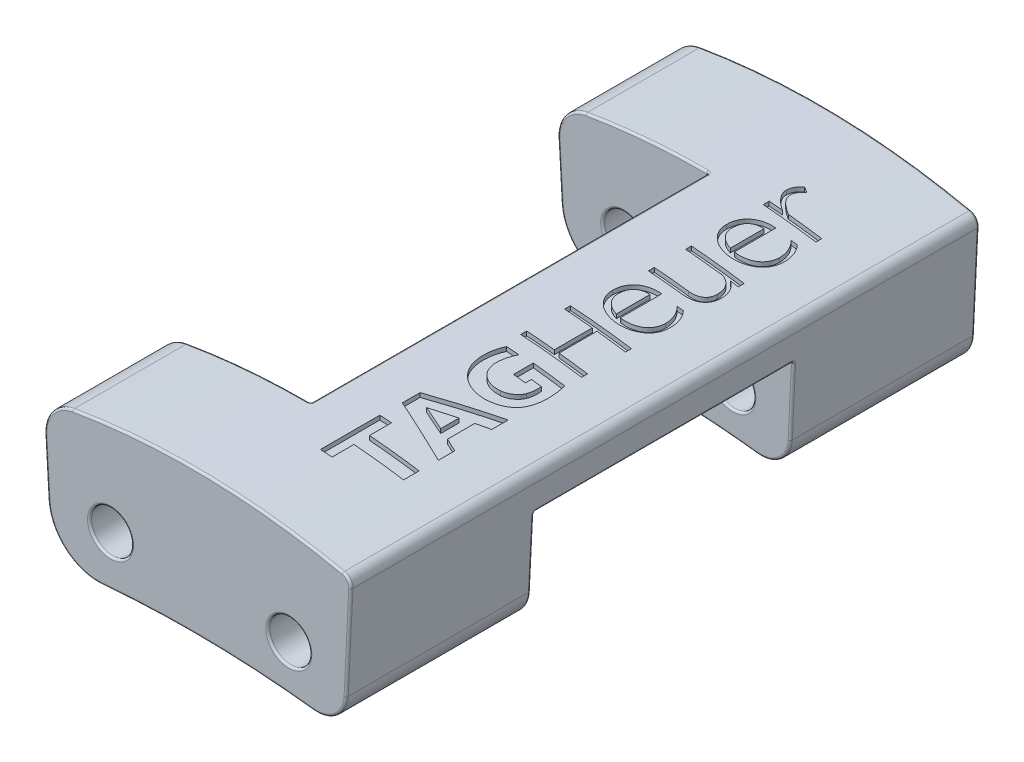
from build123d import *

# Parameters (mm, degrees)
SKETCH1_R               = 0.5
BOSS_EXTRUDE1_DEPTH     = 7.5
CUT_EXTRUDE1_DEPTH      = 15
SKETCH3_W               = 6.507782259
SKETCH3_H               = 9.5
CUT_EXTRUDE2_DEPTH      = 5
SKETCH4_W               = 15
SKETCH4_H               = 3.360747645
BOSS_EXTRUDE2_DEPTH     = 1.5
CUT_EXTRUDE3_DEPTH      = 16.644019284
BOSS_EXTRUDE3_DEPTH     = 15
SKETCH8_R               = 0.5
CUT_EXTRUDE4_DEPTH      = 16.644019284
FILLET1_R               = 0.25
FILLET2_R               = 0.7
CUT_EXTRUDE5_DEPTH      = 1
CUT_EXTRUDE5_DEPTH_BACK = 2
SKETCH9_W               = 7.495233053
SKETCH9_H               = 6.2
FILLET3_R               = 0.05
CUT_EXTRUDE6_REACH      = 20.717
CUT_EXTRUDE6_END_RADIUS = 16.9
CUT_EXTRUDE6_START      = 10


with BuildPart() as part:
    # Sketch1 → Boss-Extrude1 (new, symmetric)
    with BuildSketch(Plane.XY):
        with BuildLine():
            Line((3.214467516, 1.180191309), (3.139535455, -0.131119771))
            ThreePointArc((3.139535455, -0.131119771), (2.727253271, -0.969619698), (1.83856997, -1.258238334))
            ThreePointArc((1.83856997, -1.258238334), (-0.305594271, -1.166119811), (-2.449758512, -1.258238334))
            ThreePointArc((-2.449758512, -1.258238334), (-3.338441812, -0.969619698), (-3.750723996, -0.131119771))
            Line((-3.750723996, -0.131119771), (-3.825656058, 1.180191309))
            ThreePointArc((-3.825656058, 1.180191309), (-3.652789886, 1.724164053), (-3.161347372, 2.014462718))
            ThreePointArc((-3.161347372, 2.014462718), (-0.305594271, 2.256041723), (2.55015883, 2.014462718))
            ThreePointArc((2.55015883, 2.014462718), (3.041601344, 1.724164053), (3.214467516, 1.180191309))
        make_face()
        with Locations((-2.255594271, -0.070889968)):
            Circle(SKETCH1_R, mode=Mode.SUBTRACT)
    extrude(amount=BOSS_EXTRUDE1_DEPTH, both=True)

    # Sketch2 → Cut-Extrude1 (cut)
    with BuildSketch(Plane.XY.offset(7.5)):
        Polygon((1.83856997, -1.258238334), (2.048442209, 3.004085083), (6.043898684, 1.738990649), (3.82597996, -1.944195681), align=None)
    extrude(amount=-CUT_EXTRUDE1_DEPTH, mode=Mode.SUBTRACT)

    # Sketch3 → Cut-Extrude2 (cut, symmetric)
    with BuildSketch(Plane(origin=(0, 0, 0), x_dir=(1, 0, 0), z_dir=(0, 1, 0))):
        with Locations((-3.480850121, 0)):
            Rectangle(SKETCH3_W, SKETCH3_H)
    extrude(amount=CUT_EXTRUDE2_DEPTH, both=True, mode=Mode.SUBTRACT)

    # Sketch4 → Boss-Extrude2 (add)
    with BuildSketch(Plane(origin=(1.895927654, -0.093353447, 0), x_dir=(0, 0, -1), z_dir=(0.9987899637731681, -0.04917934796226596, 0))):
        with Locations((0, 0.514077676)):
            Rectangle(SKETCH4_W, SKETCH4_H)
    extrude(amount=BOSS_EXTRUDE2_DEPTH)

    # Sketch6 → Cut-Extrude3 (cut, through all)
    with BuildSketch(Plane.XY.offset(7.5)):
        with BuildLine():
            Line((-3.161347372, 2.014462718), (3.582877206, 4.079080063))
            Line((3.582877206, 4.079080063), (5.26786293, 2.202239529))
            Line((5.26786293, 2.202239529), (4.280334425, 1.625808307))
            ThreePointArc((4.280334425, 1.625808307), (0.58105107, 2.232904214), (-3.161347372, 2.014462718))
        make_face()
    extrude(amount=-CUT_EXTRUDE3_DEPTH, mode=Mode.SUBTRACT)

    # Sketch7 → Boss-Extrude3 (add)
    with BuildSketch(Plane.XY.offset(7.5)):
        with BuildLine():
            Line((3.378981184, -0.474428418), (3.336754915, -1.332007356))
            Line((3.336754915, -1.332007356), (3.331823925, -1.432151491))
            ThreePointArc((3.331823925, -1.432151491), (2.063975587, -1.27867039), (0.789943636, -1.190135412))
            Line((0.789943636, -1.190135412), (3.378981184, -0.474428418))
        make_face()
    extrude(amount=-BOSS_EXTRUDE3_DEPTH)

    # Sketch8 → Cut-Extrude4 (cut, through all)
    with BuildSketch(Plane.XY.offset(7.5)):
        with Locations((2, -0.2)):
            Circle(SKETCH8_R)
    extrude(amount=-CUT_EXTRUDE4_DEPTH, mode=Mode.SUBTRACT)

    # Fillet1
    fillet1_edges = [part.edges().sort_by_distance(p)[0] for p in [
        (3.492270691, 1.826383353, 0),
    ]]
    fillet(fillet1_edges, radius=FILLET1_R)

    # Fillet2
    fillet2_edges = [part.edges().sort_by_distance(p)[0] for p in [
        (3.331823925, -1.432151491, 0),
    ]]
    fillet(fillet2_edges, radius=FILLET2_R)

    # Sketch9 → Cut-Extrude5 (cut, two sides: drawn at the far end of the back side and taken through both)
    with BuildSketch(Plane(origin=(0, 0, 0), x_dir=(1, 0, 0), z_dir=(0, 1, 0)).offset(-CUT_EXTRUDE5_DEPTH_BACK)):
        with Locations((4.882888726, 0)):
            Rectangle(SKETCH9_W, SKETCH9_H)
    extrude(amount=CUT_EXTRUDE5_DEPTH + CUT_EXTRUDE5_DEPTH_BACK, mode=Mode.SUBTRACT)

    # Fillet3
    fillet3_edges = [part.edges().sort_by_distance(p)[0] for p in [
        (-3.788190027, 0.524535769, 7.5),
        (-3.652789886, 1.724164053, -7.5),
        (1.5, -0.2, -7.5),
        (1.5, -0.2, 7.5),
        (-3.338441812, -0.969619698, 7.5),
        (0.068622726, 2.251922449, 7.5),
        (0.068622726, 2.251922449, -7.5),
        (3.430562477, 1.780335166, -7.5),
        (3.42554491, 0.471240536, 7.5),
        (3.430562477, 1.780335166, 7.5),
        (3.122468898, -1.17309987, 7.5),
        (3.42554491, 0.471240536, -7.5),
        (3.122468898, -1.17309987, -7.5),
        (3.122468898, -1.17309987, -3.1),
        (3.122468898, -1.17309987, 3.1),
        (3.45158046, 1, 0),
        (1.135272199, -1.207676274, 0),
        (1.135272199, -0.103838137, -3.1),
        (3.41038249, 0.163304907, 3.1),
        (1.135272199, -0.103838137, 3.1),
        (1.5, -0.2, 3.1),
        (3.41038249, 0.163304907, -3.1),
        (1.5, -0.2, -3.1),
        (1.86305152, -1.260357919, 3.1),
        (1.86305152, -1.260357919, -3.1),
        (2.293426329, 1, -3.1),
        (1.135272199, 1, 0),
        (2.293426329, 1, 3.1),
        (0.071532724, -1.168964469, 7.5),
        (-2.755594271, -0.070889968, -7.5),
        (-2.755594271, -0.070889968, 7.5),
        (-0.226958991, -1.166243482, 0),
        (-0.226958991, 0.544808186, -4.75),
        (-0.226958991, 2.255859854, 0),
        (-3.652789886, 1.724164053, -4.75),
        (-1.699389088, 2.198808204, -4.75),
        (-1.339382564, -1.187503321, -4.75),
        (-3.338441812, -0.969619698, -4.75),
        (-3.788190027, 0.524535769, -4.75),
        (-2.755594271, -0.070889968, -4.75),
        (-0.226958991, 0.544808186, 4.75),
        (-1.699389088, 2.198808204, 4.75),
        (-3.652789886, 1.724164053, 4.75),
        (-3.788190027, 0.524535769, 4.75),
        (-3.338441812, -0.969619698, 4.75),
        (-1.339382564, -1.187503321, 4.75),
        (-2.755594271, -0.070889968, 4.75),
        (-3.652789886, 1.724164053, 7.5),
        (0.071532724, -1.168964469, -7.5),
        (-3.338441812, -0.969619698, -7.5),
        (-3.788190027, 0.524535769, -7.5),
    ]]
    fillet(fillet3_edges, radius=FILLET3_R)

    # Cut-Extrude6: up to this cylinder (the profile starts outside it)
    cut_extrude6_end = Plane(origin=(-0.305594271, -14.743958277, -0.0306075), z_dir=(0, 0, -1)) * Cylinder(CUT_EXTRUDE6_END_RADIUS, 86.012725, mode=Mode.PRIVATE)
    # Sketch11 → Cut-Extrude6 (cut, up to the surface)
    with BuildSketch(Plane(origin=(0, 0, 0), x_dir=(1, 0, 0), z_dir=(0, 1, 0)).offset(CUT_EXTRUDE6_START), mode=Mode.PRIVATE) as cut_extrude6_sk1:
        Polygon((2.284005039, -4.673143723), (1.099560127, -4.673143723), (1.099560127, -4.150187737), (0.82425228, -4.150187737), (0.82425228, -5.567337514), (1.099560127, -5.567337514), (1.099560127, -5.044352227), (2.284005039, -5.044352227), align=None)
    cut_extrude6_tool1 = extrude(cut_extrude6_sk1.sketch, amount=-CUT_EXTRUDE6_REACH, mode=Mode.PRIVATE) - cut_extrude6_end
    add(cut_extrude6_tool1.solids().sort_by_distance((1.348624, 10, 4.858755))[0], mode=Mode.SUBTRACT)
    # Sketch11 → Cut-Extrude6 (cut, up to the surface)
    with BuildSketch(Plane(origin=(0, 0, 0), x_dir=(1, 0, 0), z_dir=(0, 1, 0)).offset(CUT_EXTRUDE6_START), mode=Mode.PRIVATE) as cut_extrude6_sk2:
        with BuildLine():
            Line((0.914615137, -1.211871274), (1.203049624, -1.211871274))
            add(Edge.make_bspline(
                [(1.203049624, -1.211871274), (1.102724585, -1.430072374), (1.043771904, -1.758648597), (1.203049624, -1.968059536)],
                knots=[7, 7, 7, 7, 8, 8, 8, 8], degree=3))
            add(Edge.make_bspline(
                [(1.203049624, -1.968059536), (1.318376538, -2.118547094), (1.501446294, -2.164988446), (1.68451605, -2.127366556)],
                knots=[8, 8, 8, 8, 9, 9, 9, 9], degree=3))
            add(Edge.make_bspline(
                [(1.68451605, -2.127366556), (1.828791894, -2.097245604), (1.959237886, -1.973099228), (2.006821958, -1.835152299)],
                knots=[9, 9, 9, 9, 10, 10, 10, 10], degree=3))
            add(Edge.make_bspline(
                [(2.006821958, -1.835152299), (2.038232134, -1.737317806), (2.048311518, -1.617039101), (2.034481665, -1.507923901)],
                knots=[10, 10, 10, 10, 11, 11, 11, 11], degree=3))
            Line((2.034481665, -1.507923901), (1.799491357, -1.507923901))
            Line((1.799491357, -1.507923901), (1.799960166, -1.652053243))
            Line((1.799960166, -1.652053243), (1.516682573, -1.652053243))
            Line((1.516682573, -1.652053243), (1.516682573, -1.179582082))
            Line((1.516682573, -1.179582082), (2.269003164, -1.179582082))
            add(Edge.make_bspline(
                [(2.269003164, -1.179582082), (2.332995537, -1.463943795), (2.351747881, -1.830141908), (2.230092051, -2.094755058)],
                knots=[0, 0, 0, 0, 1, 1, 1, 1], degree=3))
            add(Edge.make_bspline(
                [(2.230092051, -2.094755058), (2.131056235, -2.320486396), (1.895245513, -2.459663947), (1.664474482, -2.488524977)],
                knots=[1, 1, 1, 1, 2, 2, 2, 2], degree=3))
            add(Edge.make_bspline(
                [(1.664474482, -2.488524977), (1.381079687, -2.518616628), (1.132728335, -2.412021274), (0.965949678, -2.185030013)],
                knots=[2, 2, 2, 2, 3, 3, 3, 3], degree=3))
            add(Edge.make_bspline(
                [(0.965949678, -2.185030013), (0.776668208, -1.920416862), (0.782879922, -1.500305761), (0.914615137, -1.211871274)],
                knots=[3, 3, 3, 3, 4, 4, 4, 4], degree=3))
        make_face()
    cut_extrude6_tool2 = extrude(cut_extrude6_sk2.sketch, amount=-CUT_EXTRUDE6_REACH, mode=Mode.PRIVATE) - cut_extrude6_end
    add(cut_extrude6_tool2.solids().sort_by_distance((1.058832, 10, 1.231813))[0], mode=Mode.SUBTRACT)
    # Sketch11 → Cut-Extrude6 (cut, up to the surface)
    with BuildSketch(Plane(origin=(0, 0, 0), x_dir=(1, 0, 0), z_dir=(0, 1, 0)).offset(CUT_EXTRUDE6_START), mode=Mode.PRIVATE) as cut_extrude6_sk3:
        Polygon((1.609155068, 0.248262392), (2.288224316, 0.247793583), (2.288224316, 0.388553363), (0.835386484, 0.388553363), (0.835386484, 0.247793583), (1.496289399, 0.248262392), (1.496289399, -0.657886019), (0.835386484, -0.657563713), (0.835386484, -0.798323493), (2.288224316, -0.798323493), (2.288224316, -0.657563713), (1.609155068, -0.657886019), align=None)
    cut_extrude6_tool3 = extrude(cut_extrude6_sk3.sketch, amount=-CUT_EXTRUDE6_REACH, mode=Mode.PRIVATE) - cut_extrude6_end
    add(cut_extrude6_tool3.solids().sort_by_distance((1.55999, 10, 0.204972))[0], mode=Mode.SUBTRACT)
    # Sketch11 → Cut-Extrude6 (cut, up to the surface)
    with BuildSketch(Plane(origin=(0, 0, 0), x_dir=(1, 0, 0), z_dir=(0, 1, 0)).offset(CUT_EXTRUDE6_START), mode=Mode.PRIVATE) as cut_extrude6_sk4:
        with BuildLine():
            Line((1.845200195, 2.194521269), (1.029942051, 2.194521269))
            Line((1.029942051, 2.194521269), (1.029942051, 2.054347499))
            Line((1.029942051, 2.054347499), (1.815196445, 2.054113095))
            add(Edge.make_bspline(
                [(1.815196445, 2.054113095), (2.290685561, 2.054113095), (2.317173247, 2.410290424), (2.317173247, 2.508974633)],
                knots=[7, 7, 7, 7, 8, 8, 8, 8], degree=3))
            add(Edge.make_bspline(
                [(2.317173247, 2.508974633), (2.317173247, 2.808426122), (2.098825644, 2.941567763)],
                knots=[8, 8, 8, 9, 9, 9], degree=2))
            Line((2.098825644, 2.941567763), (2.287286699, 2.941098954))
            Line((2.287286699, 2.941098954), (2.287286699, 3.081858734))
            Line((2.287286699, 3.081858734), (1.029942051, 3.081858734))
            Line((1.029942051, 3.081858734), (1.029942051, 2.941567763))
            Line((1.029942051, 2.941567763), (1.925366465, 2.941098954))
            add(Edge.make_bspline(
                [(1.925366465, 2.941098954), (2.204307578, 2.844524384), (2.204307578, 2.531008637)],
                knots=[0, 0, 0, 1, 1, 1], degree=2))
            add(Edge.make_bspline(
                [(2.204307578, 2.531008637), (2.204307578, 2.275976762), (2.0254571, 2.194521269), (1.845200195, 2.194521269)],
                knots=[1, 1, 1, 1, 2, 2, 2, 2], degree=3))
        make_face()
    cut_extrude6_tool4 = extrude(cut_extrude6_sk4.sketch, amount=-CUT_EXTRUDE6_REACH, mode=Mode.PRIVATE) - cut_extrude6_end
    add(cut_extrude6_tool4.solids().sort_by_distance((1.437571, 10, -2.178049))[0], mode=Mode.SUBTRACT)
    # Sketch11 → Cut-Extrude6 (cut, up to the surface)
    with BuildSketch(Plane(origin=(0, 0, 0), x_dir=(1, 0, 0), z_dir=(0, 1, 0)).offset(CUT_EXTRUDE6_START), mode=Mode.PRIVATE) as cut_extrude6_sk5:
        with BuildLine():
            Line((1.344629819, 4.935176308), (1.031817285, 4.935645116))
            Line((1.031817285, 4.935645116), (1.031817285, 4.794885336))
            Line((1.031817285, 4.794885336), (2.289161933, 4.794885336))
            Line((2.289161933, 4.794885336), (2.289161933, 4.935176308))
            Line((2.289161933, 4.935176308), (1.489960483, 4.935645116))
            add(Edge.make_bspline(
                [(1.489960483, 4.935645116), (1.143979741, 5.134888769), (1.143979741, 5.32534226)],
                knots=[9, 9, 9, 10, 10, 10], degree=2))
            add(Edge.make_bspline(
                [(1.143979741, 5.32534226), (1.143979741, 5.456022655), (1.283684702, 5.584007401)],
                knots=[10, 10, 10, 11, 11, 11], degree=2))
            Line((1.283684702, 5.584007401), (1.154527934, 5.659251181))
            add(Edge.make_bspline(
                [(1.154527934, 5.659251181), (1.009666079, 5.530914828), (1.009666079, 5.370347885)],
                knots=[0, 0, 0, 1, 1, 1], degree=2))
            add(Edge.make_bspline(
                [(1.009666079, 5.370347885), (1.009666079, 5.155281942), (1.344629819, 4.935176308)],
                knots=[1, 1, 1, 2, 2, 2], degree=2))
        make_face()
    cut_extrude6_tool5 = extrude(cut_extrude6_sk5.sketch, amount=-CUT_EXTRUDE6_REACH, mode=Mode.PRIVATE) - cut_extrude6_end
    add(cut_extrude6_tool5.solids().sort_by_distance((1.1882, 10, -4.91997))[0], mode=Mode.SUBTRACT)
    # Sketch11 → Cut-Extrude6 (cut, up to the surface)
    with BuildSketch(Plane(origin=(0, 0, 0), x_dir=(1, 0, 0), z_dir=(0, 1, 0)).offset(CUT_EXTRUDE6_START), mode=Mode.PRIVATE) as cut_extrude6_sk6:
        Polygon((2.006821958, -3.718942431), (2.2927952, -3.831016986), (2.2927952, -4.222296358), (0.83679291, -3.626528537), (0.83679291, -3.202110257), (2.2927952, -2.557498441), (2.2927952, -2.948777813), (2.006821958, -3.068236103), align=None)
        Polygon((1.742296709, -3.180779466), (1.198009932, -3.407243318), (1.742296709, -3.616595655), align=None, mode=Mode.SUBTRACT)
    cut_extrude6_tool6 = extrude(cut_extrude6_sk6.sketch, amount=-CUT_EXTRUDE6_REACH, mode=Mode.PRIVATE) - cut_extrude6_end
    add(cut_extrude6_tool6.solids().sort_by_distance((2.141739, 10, 3.795572))[0], mode=Mode.SUBTRACT)
    # Sketch11 → Cut-Extrude6 (cut, up to the surface)
    with BuildSketch(Plane(origin=(0, 0, 0), x_dir=(1, 0, 0), z_dir=(0, 1, 0)).offset(CUT_EXTRUDE6_START), mode=Mode.PRIVATE) as cut_extrude6_sk7:
        with BuildLine():
            Line((2.002251074, 1.770366693), (2.14769894, 1.770366693))
            add(Edge.make_bspline(
                [(2.14769894, 1.770366693), (2.314829204, 1.588820565), (2.314829204, 1.289369076)],
                knots=[6, 6, 6, 7, 7, 7], degree=2))
            add(Edge.make_bspline(
                [(2.314829204, 1.289369076), (2.314829204, 0.834741942), (1.927710508, 0.655305453), (1.654863906, 0.655305453)],
                knots=[7, 7, 7, 7, 8, 8, 8, 8], degree=3))
            add(Edge.make_bspline(
                [(1.654863906, 0.655305453), (1.298569375, 0.655305453), (1.004626387, 0.886779696), (1.004626387, 1.223267065)],
                knots=[8, 8, 8, 8, 9, 9, 9, 9], degree=3))
            add(Edge.make_bspline(
                [(1.004626387, 1.223267065), (1.004626387, 1.603705238), (1.299858599, 1.79415873), (1.610209888, 1.79415873)],
                knots=[9, 9, 9, 9, 10, 10, 10, 10], degree=3))
            Line((1.610209888, 1.79415873), (1.610209888, 0.805558607))
            add(Edge.make_bspline(
                [(1.610209888, 0.805558607), (1.624742954, 0.804738192), (1.638572808, 0.804269384), (1.653340278, 0.804269384)],
                knots=[0, 0, 0, 0, 1, 1, 1, 1], degree=3))
            add(Edge.make_bspline(
                [(1.653340278, 0.804269384), (1.960644311, 0.804269384), (2.19024332, 1.006208686), (2.19024332, 1.305074164)],
                knots=[1, 1, 1, 1, 2, 2, 2, 2], degree=3))
            add(Edge.make_bspline(
                [(2.19024332, 1.305074164), (2.19024332, 1.574756308), (2.002251074, 1.770366693)],
                knots=[2, 2, 2, 3, 3, 3], degree=2))
        make_face()
        with BuildLine():
            Line((1.495351782, 0.82313893), (1.495351782, 1.628669296))
            add(Edge.make_bspline(
                [(1.495351782, 1.628669296), (1.132845537, 1.60218161), (1.132845537, 1.222563852)],
                knots=[2, 2, 2, 3, 3, 3], degree=2))
            add(Edge.make_bspline(
                [(1.132845537, 1.222563852), (1.132845537, 1.008201122), (1.292123257, 0.869902587), (1.495351782, 0.82313893)],
                knots=[3, 3, 3, 3, 4, 4, 4, 4], degree=3))
        make_face(mode=Mode.SUBTRACT)
    cut_extrude6_tool7 = extrude(cut_extrude6_sk7.sketch, amount=-CUT_EXTRUDE6_REACH, mode=Mode.PRIVATE) - cut_extrude6_end
    add(cut_extrude6_tool7.solids().sort_by_distance((2.074975, 10, -1.753007))[0], mode=Mode.SUBTRACT)
    # Sketch11 → Cut-Extrude6 (cut, up to the surface)
    with BuildSketch(Plane(origin=(0, 0, 0), x_dir=(1, 0, 0), z_dir=(0, 1, 0)).offset(CUT_EXTRUDE6_START), mode=Mode.PRIVATE) as cut_extrude6_sk8:
        with BuildLine():
            Line((2.002251074, 4.491683378), (2.14769894, 4.491683378))
            add(Edge.make_bspline(
                [(2.14769894, 4.491683378), (2.314829204, 4.310254452), (2.314829204, 4.010802963)],
                knots=[6, 6, 6, 7, 7, 7], degree=2))
            add(Edge.make_bspline(
                [(2.314829204, 4.010802963), (2.314829204, 3.556175829), (1.927710508, 3.376622138), (1.654863906, 3.376622138)],
                knots=[7, 7, 7, 7, 8, 8, 8, 8], degree=3))
            add(Edge.make_bspline(
                [(1.654863906, 3.376622138), (1.298569375, 3.376622138), (1.004626387, 3.608213583), (1.004626387, 3.944700951)],
                knots=[8, 8, 8, 8, 9, 9, 9, 9], degree=3))
            add(Edge.make_bspline(
                [(1.004626387, 3.944700951), (1.004626387, 4.325139125), (1.299858599, 4.515592616), (1.610209888, 4.515592616)],
                knots=[9, 9, 9, 9, 10, 10, 10, 10], degree=3))
            Line((1.610209888, 4.515592616), (1.610209888, 3.526992494))
            add(Edge.make_bspline(
                [(1.610209888, 3.526992494), (1.624742954, 3.526054877), (1.638572808, 3.525586068), (1.653340278, 3.525586068)],
                knots=[0, 0, 0, 0, 1, 1, 1, 1], degree=3))
            add(Edge.make_bspline(
                [(1.653340278, 3.525586068), (1.960644311, 3.525586068), (2.19024332, 3.72752537), (2.19024332, 4.026508051)],
                knots=[1, 1, 1, 1, 2, 2, 2, 2], degree=3))
            add(Edge.make_bspline(
                [(2.19024332, 4.026508051), (2.19024332, 4.296072992), (2.002251074, 4.491683378)],
                knots=[2, 2, 2, 3, 3, 3], degree=2))
        make_face()
        with BuildLine():
            Line((1.495351782, 3.544572816), (1.495351782, 4.349985981))
            add(Edge.make_bspline(
                [(1.495351782, 4.349985981), (1.132845537, 4.323615497), (1.132845537, 3.943880536)],
                knots=[2, 2, 2, 3, 3, 3], degree=2))
            add(Edge.make_bspline(
                [(1.132845537, 3.943880536), (1.132845537, 3.729635009), (1.292123257, 3.591336474), (1.495351782, 3.544572816)],
                knots=[3, 3, 3, 3, 4, 4, 4, 4], degree=3))
        make_face(mode=Mode.SUBTRACT)
    cut_extrude6_tool8 = extrude(cut_extrude6_sk8.sketch, amount=-CUT_EXTRUDE6_REACH, mode=Mode.PRIVATE) - cut_extrude6_end
    add(cut_extrude6_tool8.solids().sort_by_distance((2.074975, 10, -4.474323))[0], mode=Mode.SUBTRACT)


solid = part.part
